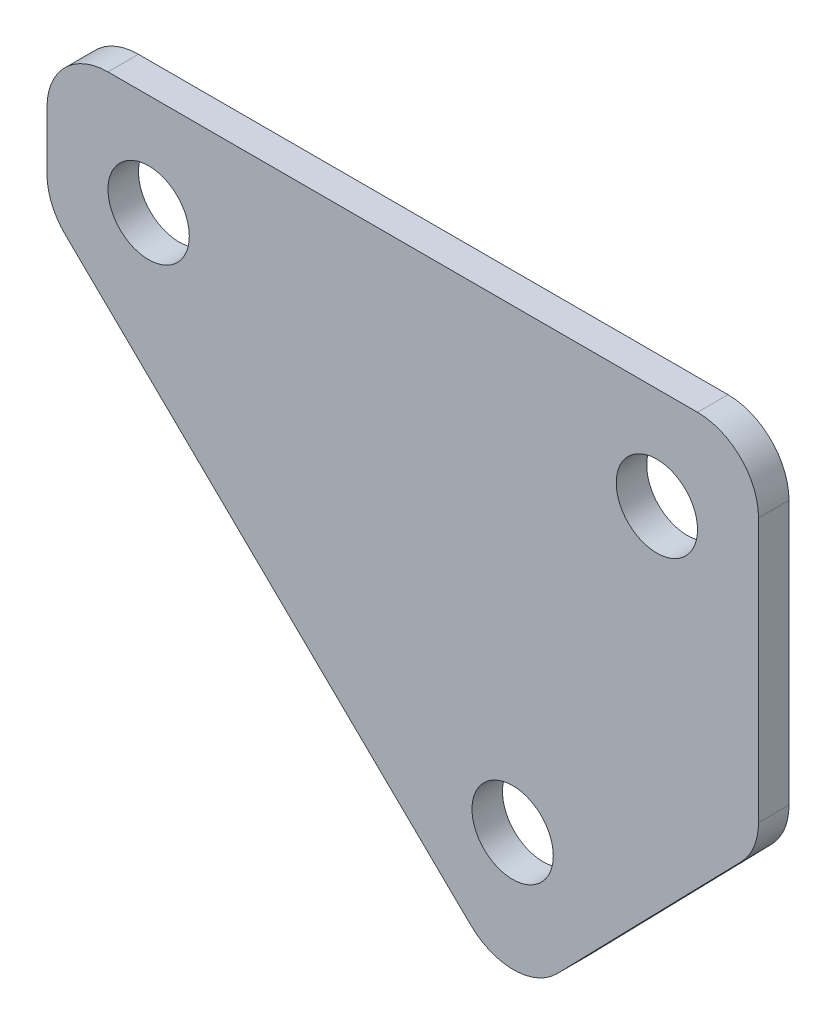
from build123d import *

# Parameters (mm, degrees)
SKETCH_1_R      = 2
EXTRUDE_1_DEPTH = 1.5
FILLET_1_R      = 3


with BuildPart() as part:
    # ｽｹｯﾁ1 → ﾎﾞｽ - 押し出し1 (new body)
    with BuildSketch(Plane.XY):
        Polygon((-17.5, 7.650184139), (5.495827016, -14.759182375), (17.5, -2.440856231), (17.5, 14.759182375), (-17.5, 14.759182375), align=None)
        with Locations((5.404503628, -7.688704312)):
            Circle(SKETCH_1_R, mode=Mode.SUBTRACT)
        with Locations((-12.5, 9.759182375)):
            Circle(SKETCH_1_R, mode=Mode.SUBTRACT)
        with Locations((12.5, 9.759182375)):
            Circle(SKETCH_1_R, mode=Mode.SUBTRACT)
    extrude(amount=EXTRUDE_1_DEPTH)

    # ﾌｨﾚｯﾄ1
    fillet_1_edges = [part.edges().sort_by_distance(p)[0] for p in [
        (-17.5, 7.650184139, 0.75),
        (-17.5, 14.759182375, 0.75),
        (17.5, 14.759182375, 0.75),
        (17.5, -2.440856231, 0.75),
        (5.495827016, -14.759182375, 0.75),
    ]]
    fillet(fillet_1_edges, radius=FILLET_1_R)


solid = part.part
